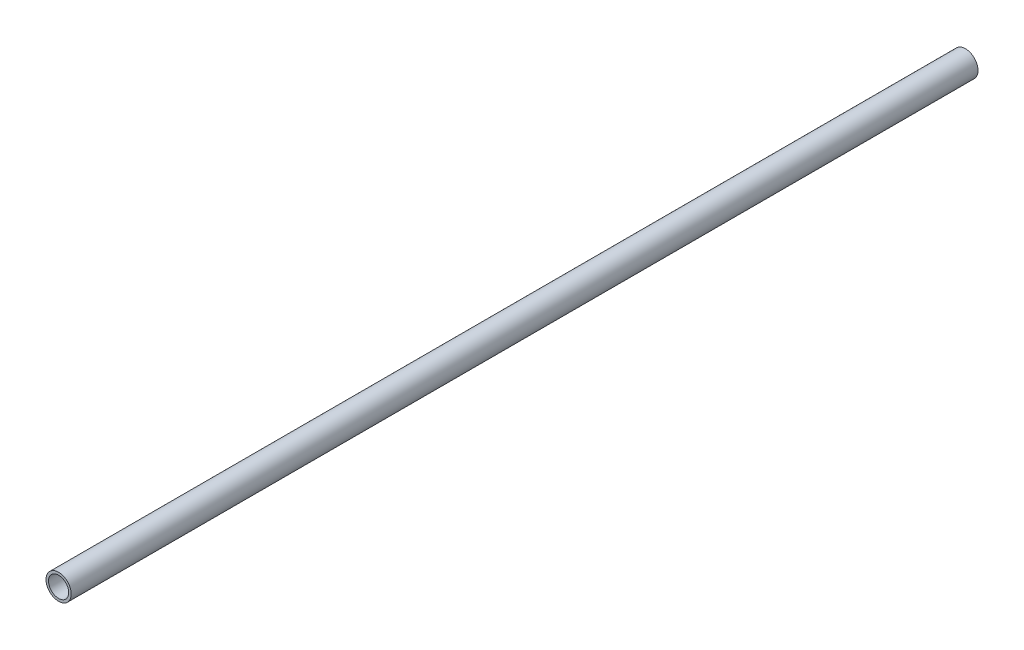
from build123d import *

# Parameters (mm, degrees)
SKETCH_1_R      = 5
SKETCH_1_R_2    = 4
EXTRUDE_1_DEPTH = 360


with BuildPart() as part:
    # 草图1 → 凸台-拉伸1 (new body)
    with BuildSketch(Plane.XY):
        with Locations(Location((0, 0, 0), (0, 0, 180))):
            Circle(SKETCH_1_R)
        with Locations(Location((0, 0, 0), (0, 0, 180))):
            Circle(SKETCH_1_R_2, mode=Mode.SUBTRACT)
    extrude(amount=EXTRUDE_1_DEPTH)


solid = part.part
